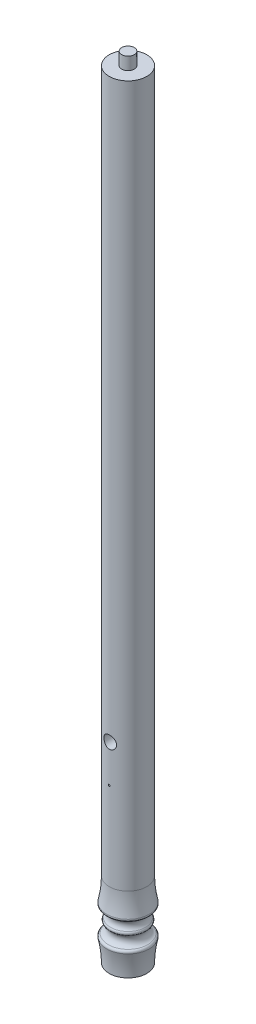
from build123d import *

# Parameters (mm, degrees)
CUT_EXTRUDE3_START = -19.05
SKETCH17_R         = 6.35
CUT_EXTRUDE3_DEPTH = 19.05
CUT_EXTRUDE4_START = -12.7
SKETCH18_R         = 0.9921875
CUT_EXTRUDE4_DEPTH = 12.7
CUT_EXTRUDE5_START = -12.7
SKETCH19_R         = 0.9921875
CUT_EXTRUDE5_DEPTH = 12.7


with BuildPart() as part:
    # revolve sketch → Revolve1 (revolve)
    with BuildSketch(Plane.XY, mode=Mode.PRIVATE) as revolve1_sk:
        with BuildLine():
            Line((0, 0), (19.05, 0))
            ThreePointArc((19.05, 0), (19.692539758, 11.497446902), (21.612156952, 22.851706562))
            ThreePointArc((21.612156952, 22.851706562), (21.368821871, 24.623609523), (20.018018165, 25.795864363))
            ThreePointArc((20.018018165, 25.795864363), (17.012666806, 28.123144244), (15.875, 31.75))
            ThreePointArc((15.875, 31.75), (16.370840305, 34.209941923), (17.780925752, 36.285714286))
            ThreePointArc((17.780925752, 36.285714286), (18.543296053, 38.1), (17.780925752, 39.914285714))
            ThreePointArc((17.780925752, 39.914285714), (16.370840305, 41.990058077), (15.875, 44.45))
            ThreePointArc((15.875, 44.45), (17.012666806, 48.076855756), (20.018018165, 50.404135637))
            ThreePointArc((20.018018165, 50.404135637), (21.368821871, 51.576390477), (21.612156952, 53.348293438))
            ThreePointArc((21.612156952, 53.348293438), (19.692539758, 64.702553098), (19.05, 76.2))
            Line((19.05, 76.2), (19.05, 787.4))
            Line((19.05, 787.4), (6.35, 787.4))
            Line((6.35, 787.4), (6.35, 800.1))
            Line((6.35, 800.1), (0, 800.1))
            Line((0, 800.1), (0, 0))
        make_face()
    revolve(revolve1_sk.sketch.rotate(Axis((0, -55, 0), (0, 1, 0)), 90), axis=Axis((0, -55, 0), (0, 1, 0)))

    # Sketch17 → Cut-Extrude3 (cut)
    with BuildSketch(Plane.XY.offset(19.05).offset(CUT_EXTRUDE3_START)):
        with Locations((0, 203.2)):
            Circle(SKETCH17_R)
    extrude(amount=CUT_EXTRUDE3_DEPTH, mode=Mode.SUBTRACT)

    # Sketch18 → Cut-Extrude4 (cut)
    with BuildSketch(Plane.XY.offset(19.05).offset(CUT_EXTRUDE4_START)):
        with Locations((0, 165.1)):
            Circle(SKETCH18_R)
    extrude(amount=CUT_EXTRUDE4_DEPTH, mode=Mode.SUBTRACT)

    # Sketch19 → Cut-Extrude5 (cut)
    with BuildSketch(Plane.ZY.offset(19.05).offset(CUT_EXTRUDE5_START)):
        with Locations((0, 317.5)):
            Circle(SKETCH19_R)
    extrude(amount=CUT_EXTRUDE5_DEPTH, mode=Mode.SUBTRACT)


solid = part.part
